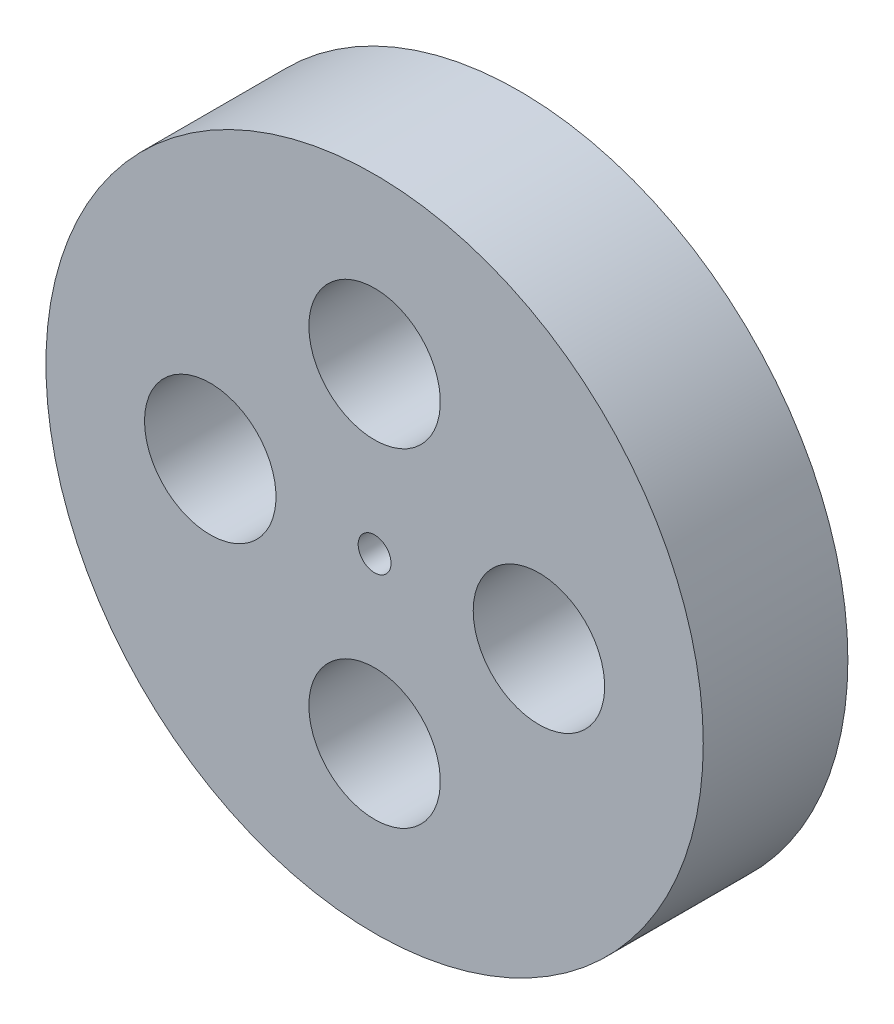
from build123d import *

# Parameters (mm, degrees)
ESQUISSE1_R             = 50
BOSS_EXTRU_1_DEPTH      = 22
ESQUISSE2_R             = 2.5
ENL_V_MAT_EXTRU_1_DEPTH = 7
ENL_V_START             = -15
ENL_V_MAT_EXTRU_3_DEPTH = 15
ESQUISSE4_R             = 10
ENL_V_MAT_EXTRU_5_DEPTH = 22
ESQUISSE5_R             = 10
ENL_V_MAT_EXTRU_6_DEPTH = 22
ESQUISSE6_R             = 10
ENL_V_MAT_EXTRU_7_DEPTH = 22
ESQUISSE7_R             = 10
ENL_V_MAT_EXTRU_8_DEPTH = 22


with BuildPart() as part:
    # Esquisse1 → Boss.-Extru.1 (new body)
    with BuildSketch(Plane.XY):
        Circle(ESQUISSE1_R)
    extrude(amount=BOSS_EXTRU_1_DEPTH)

    # Esquisse2 → Enlèv. mat.-Extru.1 (cut)
    with BuildSketch(Plane.XY.offset(22)):
        Circle(ESQUISSE2_R)
    extrude(amount=-ENL_V_MAT_EXTRU_1_DEPTH, mode=Mode.SUBTRACT)

    # Esquisse3 → Enlèv. mat.-Extru.3 (cut)
    with BuildSketch(Plane(origin=(0, 0, 0), x_dir=(-1, 0, 0), z_dir=(0, 0, -1)).offset(ENL_V_START)):
        with BuildLine():
            ThreePointArc((2.5, 0), (0.559569372, 2.436571796), (-2.249505694, 1.09074476))
            Line((-2.249505694, 1.09074476), (-2.366104086, -0.807187373))
            ThreePointArc((-2.366104086, -0.807187373), (0.409108657, -2.466298868), (2.5, 0))
        make_face()
    extrude(amount=ENL_V_MAT_EXTRU_3_DEPTH, mode=Mode.SUBTRACT)

    # Esquisse4 → Enlèv. mat.-Extru.5 (cut)
    with BuildSketch(Plane(origin=(0, 0, 0), x_dir=(-1, 0, 0), z_dir=(0, 0, -1))):
        with Locations((0, 25)):
            Circle(ESQUISSE4_R)
    extrude(amount=-ENL_V_MAT_EXTRU_5_DEPTH, mode=Mode.SUBTRACT)

    # Esquisse5 → Enlèv. mat.-Extru.6 (cut)
    with BuildSketch(Plane(origin=(0, 0, 0), x_dir=(-1, 0, 0), z_dir=(0, 0, -1))):
        with Locations((25, 0)):
            Circle(ESQUISSE5_R)
    extrude(amount=-ENL_V_MAT_EXTRU_6_DEPTH, mode=Mode.SUBTRACT)

    # Esquisse6 → Enlèv. mat.-Extru.7 (cut)
    with BuildSketch(Plane(origin=(0, 0, 0), x_dir=(-1, 0, 0), z_dir=(0, 0, -1))):
        with Locations((0, -25)):
            Circle(ESQUISSE6_R)
    extrude(amount=-ENL_V_MAT_EXTRU_7_DEPTH, mode=Mode.SUBTRACT)

    # Esquisse7 → Enlèv. mat.-Extru.8 (cut)
    with BuildSketch(Plane(origin=(0, 0, 0), x_dir=(-1, 0, 0), z_dir=(0, 0, -1))):
        with Locations((-25, 0)):
            Circle(ESQUISSE7_R)
    extrude(amount=-ENL_V_MAT_EXTRU_8_DEPTH, mode=Mode.SUBTRACT)


solid = part.part
